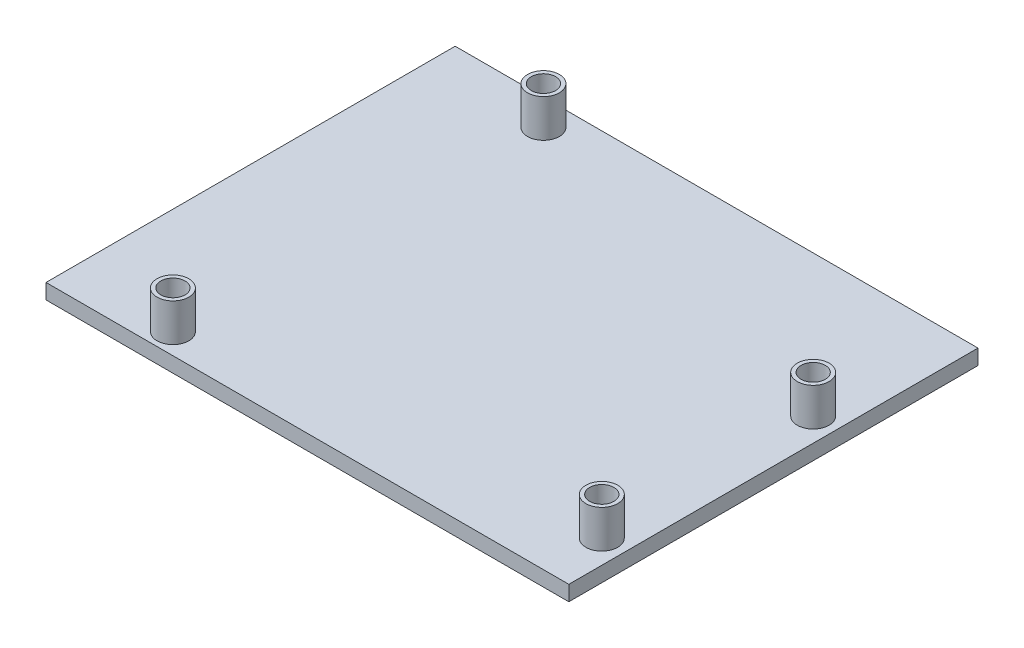
from build123d import *

# Parameters (mm, degrees)
SKETCH1_W           = 69
SKETCH1_H           = 54
BOSS_EXTRUDE1_DEPTH = 2
SKETCH2_R           = 2.1
SKETCH2_R_2         = 1.6
BOSS_EXTRUDE2_DEPTH = 5


with BuildPart() as part:
    # Sketch1 → Boss-Extrude1 (new body)
    with BuildSketch(Plane(origin=(0, 0, 0), x_dir=(1, 0, 0), z_dir=(0, 1, 0))):
        Rectangle(SKETCH1_W, SKETCH1_H)
    extrude(amount=BOSS_EXTRUDE1_DEPTH)

    # Sketch2 → Boss-Extrude2 (add)
    # profile 1 of 4: a face of its own
    with BuildSketch(Plane(origin=(0, 2, 0), x_dir=(1, 0, 0), z_dir=(0, 1, 0))):
        with Locations(Location((-19.4, 23.55, 0), (0, 0, 90))):
            Circle(SKETCH2_R)
        with Locations(Location((-19.4, 23.55, 0), (0, 0, 270))):
            Circle(SKETCH2_R_2, mode=Mode.SUBTRACT)
    # profile 2 of 4: a face of its own
    with BuildSketch(Plane(origin=(0, 2, 0), x_dir=(1, 0, 0), z_dir=(0, 1, 0))):
        with Locations(Location((31.4, 8.35, 0), (0, 0, 90))):
            Circle(SKETCH2_R)
        with Locations(Location((31.4, 8.35, 0), (0, 0, 270))):
            Circle(SKETCH2_R_2, mode=Mode.SUBTRACT)
    # profile 3 of 4: a face of its own
    with BuildSketch(Plane(origin=(0, 2, 0), x_dir=(1, 0, 0), z_dir=(0, 1, 0))):
        with Locations(Location((31.4, -19.55, 0), (0, 0, 90))):
            Circle(SKETCH2_R)
        with Locations(Location((31.4, -19.55, 0), (0, 0, 270))):
            Circle(SKETCH2_R_2, mode=Mode.SUBTRACT)
    # profile 4 of 4: a face of its own
    with BuildSketch(Plane(origin=(0, 2, 0), x_dir=(1, 0, 0), z_dir=(0, 1, 0))):
        with Locations(Location((-20.5, -24.25, 0), (0, 0, 90))):
            Circle(SKETCH2_R)
        with Locations(Location((-20.5, -24.25, 0), (0, 0, 270))):
            Circle(SKETCH2_R_2, mode=Mode.SUBTRACT)
    extrude(amount=BOSS_EXTRUDE2_DEPTH)


solid = part.part
